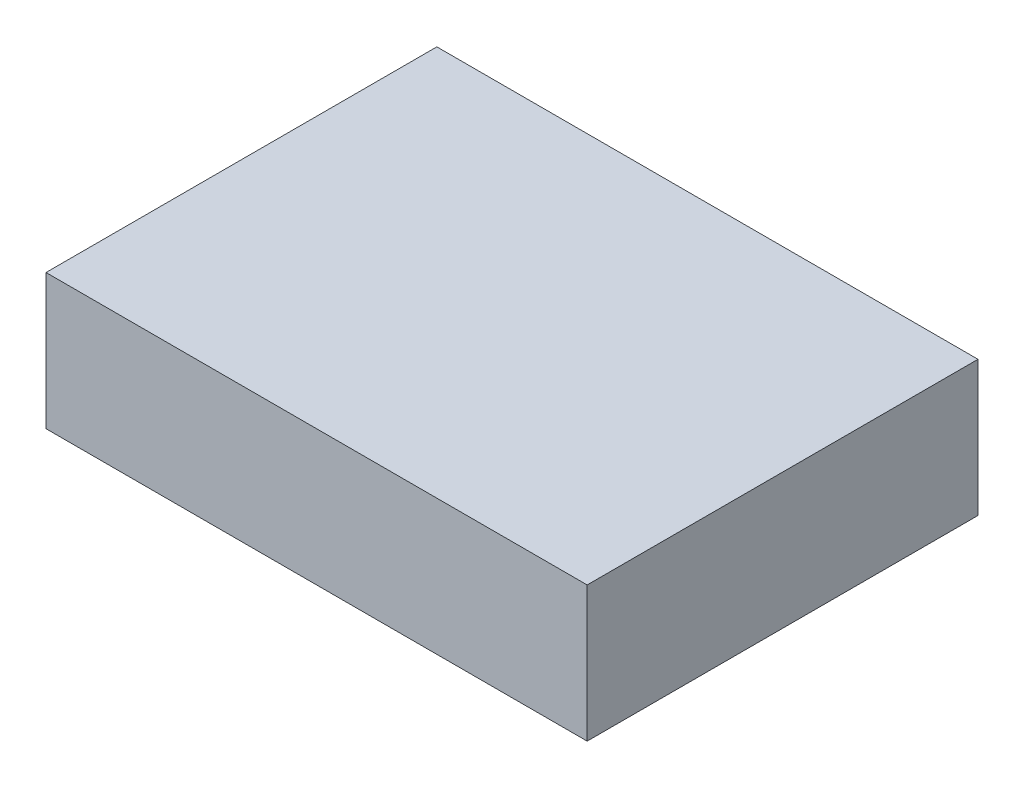
from build123d import *

# Parameters (mm, degrees)
SKETCH_1_W      = 36
SKETCH_1_H      = 26
EXTRUDE_1_DEPTH = 9


with BuildPart() as part:
    # 草图1 → 凸台-拉伸1 (new body)
    with BuildSketch(Plane(origin=(0, 0, 0), x_dir=(1, 0, 0), z_dir=(0, 1, 0))):
        Rectangle(SKETCH_1_W, SKETCH_1_H)
    extrude(amount=EXTRUDE_1_DEPTH)


solid = part.part
